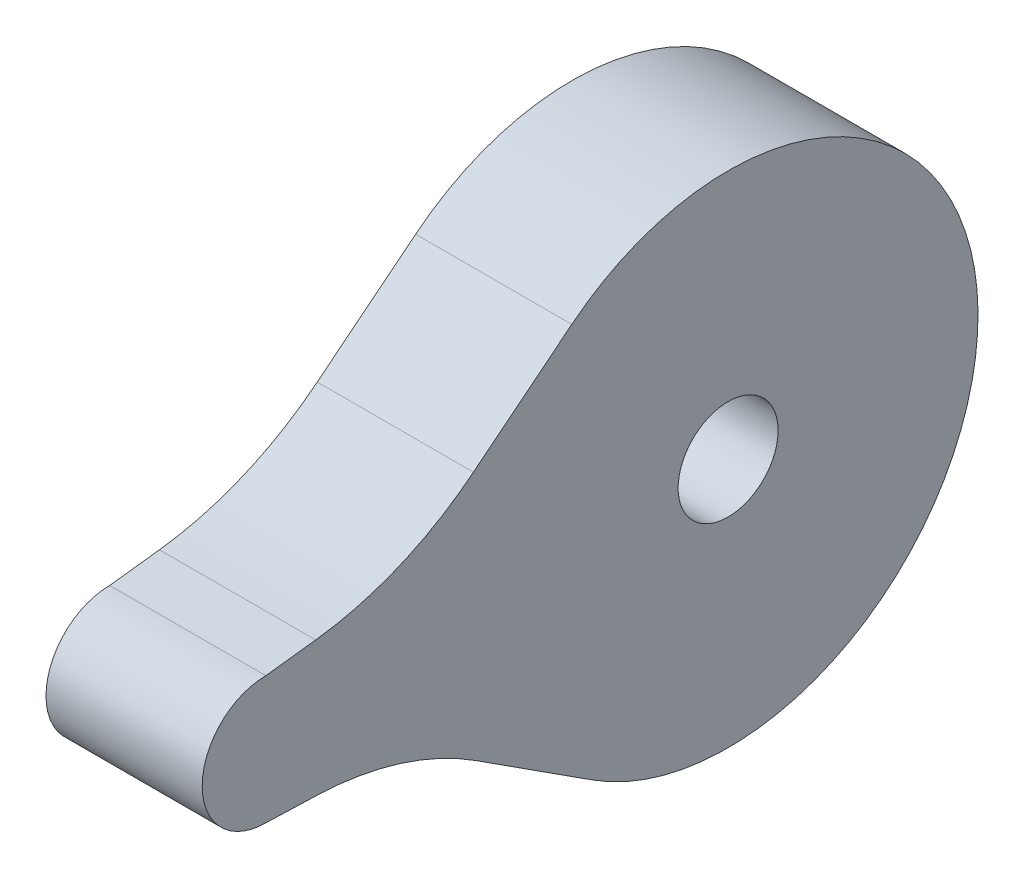
from build123d import *

# Parameters (mm, degrees)
SKETCH2_R           = 8
SKETCH2_R_2         = 1.6
BOSS_EXTRUDE1_DEPTH = 5
BOSS_EXTRUDE2_START = -5
BOSS_EXTRUDE2_DEPTH = 5
FILLET1_R           = 10
FILLET2_R           = 10


with BuildPart() as part:
    # Sketch2 → Boss-Extrude1 (new body)
    with BuildSketch(Plane(origin=(0, 0, 0), x_dir=(0, 0, -1), z_dir=(1, 0, 0))):
        Circle(SKETCH2_R)
        Circle(SKETCH2_R_2, mode=Mode.SUBTRACT)
    extrude(amount=BOSS_EXTRUDE1_DEPTH)

    # Sketch3 → Boss-Extrude2 (add)
    with BuildSketch(Plane(origin=(5, 0, 0), x_dir=(0, 0, -1), z_dir=(1, 0, 0)).offset(BOSS_EXTRUDE2_START)):
        with BuildLine():
            Line((-10.375290129, -2.83397632), (-4.331302353, -6.726055302))
            ThreePointArc((-4.331302353, -6.726055302), (-7.989266236, -0.414276496), (-5.003749355, 6.241994264))
            Line((-5.003749355, 6.241994264), (-10.375290129, 1.93602368))
            Line((-10.375290129, 1.93602368), (-14.796152799, 1.399716967))
            ThreePointArc((-14.796152799, 1.399716967), (-16.836152799, -0.640283033), (-14.796152799, -2.680283033))
            Line((-14.796152799, -2.680283033), (-10.375290129, -2.83397632))
        make_face()
    extrude(amount=BOSS_EXTRUDE2_DEPTH)

    # Fillet1
    fillet1_edges = [part.edges().sort_by_distance(p)[0] for p in [
        (2.5, 1.93602368, 10.375290129),
    ]]
    fillet(fillet1_edges, radius=FILLET1_R)

    # Fillet2
    fillet2_edges = [part.edges().sort_by_distance(p)[0] for p in [
        (2.5, -2.83397632, 10.375290129),
    ]]
    fillet(fillet2_edges, radius=FILLET2_R)


solid = part.part
